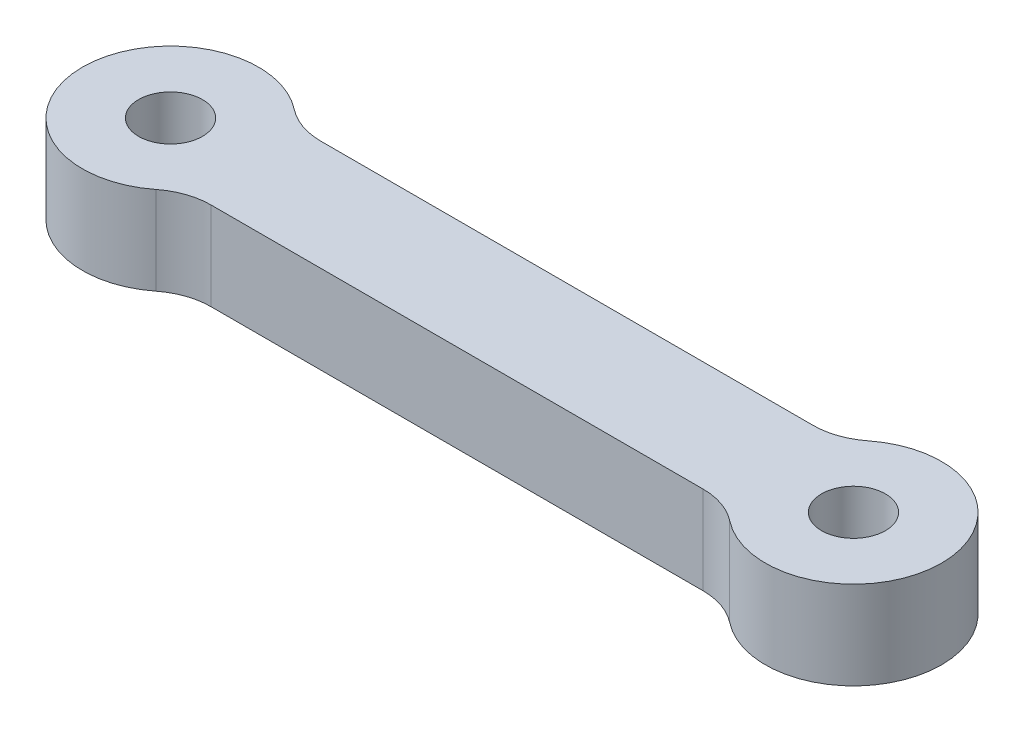
from build123d import *

# Parameters (mm, degrees)
SKETCH1_R           = 1.45
BOSS_EXTRUDE1_DEPTH = 4
FILLET1_R           = 3


with BuildPart() as part:
    # Sketch1 → Boss-Extrude1 (new body)
    with BuildSketch(Plane(origin=(0, 0, 0), x_dir=(1, 0, 0), z_dir=(0, 1, 0))):
        with BuildLine():
            ThreePointArc((3.122498999, 2.5), (-4, 0), (3.122498999, -2.5))
            Line((3.122498999, -2.5), (27.877501001, -2.5))
            ThreePointArc((27.877501001, -2.5), (35, 0), (27.877501001, 2.5))
            Line((27.877501001, 2.5), (3.122498999, 2.5))
        make_face()
        with Locations(Location((0, 0, 0), (0, 0, 270))):
            Circle(SKETCH1_R, mode=Mode.SUBTRACT)
        with Locations(Location((31, 0, 0), (0, 0, 270))):
            Circle(SKETCH1_R, mode=Mode.SUBTRACT)
    extrude(amount=BOSS_EXTRUDE1_DEPTH)

    # Fillet1
    fillet1_edges = [part.edges().sort_by_distance(p)[0] for p in [
        (27.877501001, 2, 2.5),
        (3.122498999, 2, 2.5),
        (3.122498999, 2, -2.5),
        (27.877501001, 2, -2.5),
    ]]
    fillet(fillet1_edges, radius=FILLET1_R)


solid = part.part
